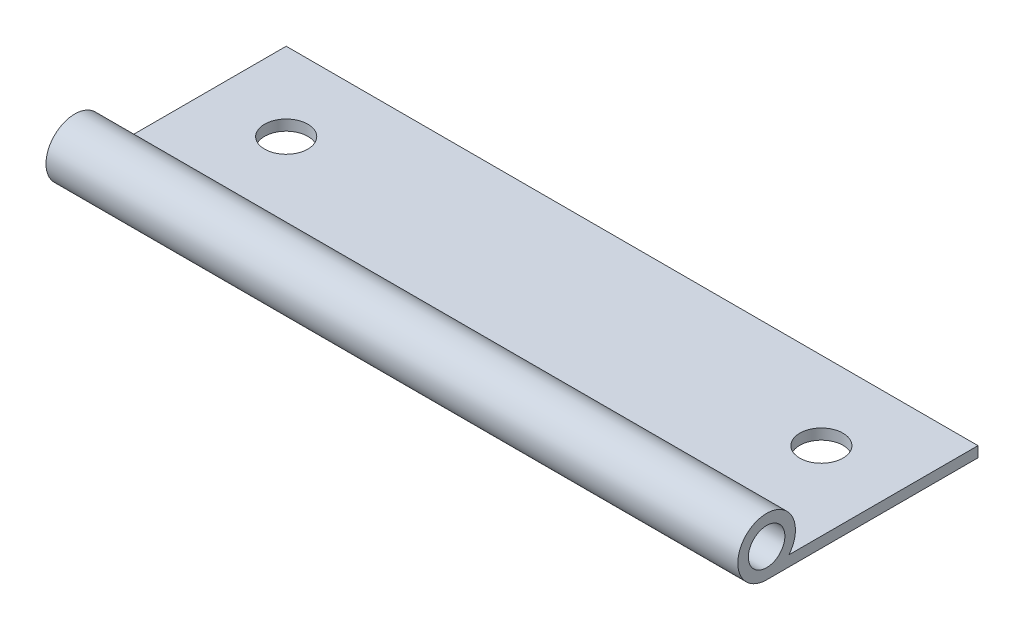
from build123d import *

# Parameters (mm, degrees)
SKETCH_1_R          = 1.9
EXTRUDE_1_DEPTH     = 72
SKETCH_2_R          = 2.25
CUT_EXTRUDE_1_DEPTH = 75.625799828


with BuildPart() as part:
    # 草图1 → 凸台-拉伸1 (new body)
    with BuildSketch(Plane(origin=(0, 0, 0), x_dir=(0, 0, -1), z_dir=(1, 0, 0))):
        with BuildLine():
            Line((0, 0), (19, 0))
            Line((19, 0), (19, -1.1))
            Line((19, -1.1), (0, -1.1))
            Line((0, -1.1), (-3, -1.1))
            ThreePointArc((-3, -1.1), (-4.284523258, 4.611088342), (-0.678362647, 0))
            Line((-0.678362647, 0), (0, 0))
        make_face()
        with Locations((-3, 1.9)):
            Circle(SKETCH_1_R, mode=Mode.SUBTRACT)
    extrude(amount=EXTRUDE_1_DEPTH)

    # 草图2 → 切除-拉伸1 (cut, through all)
    with BuildSketch(Plane(origin=(0, 0, 0), x_dir=(1, 0, 0), z_dir=(0, 1, 0))):
        with Locations(Location((8.15, 10.85, 0), (0, 0, 270))):
            Circle(SKETCH_2_R)
        with Locations(Location((63.85, 10.85, 0), (0, 0, 90))):
            Circle(SKETCH_2_R)
    extrude(amount=-CUT_EXTRUDE_1_DEPTH, mode=Mode.SUBTRACT)


solid = part.part
